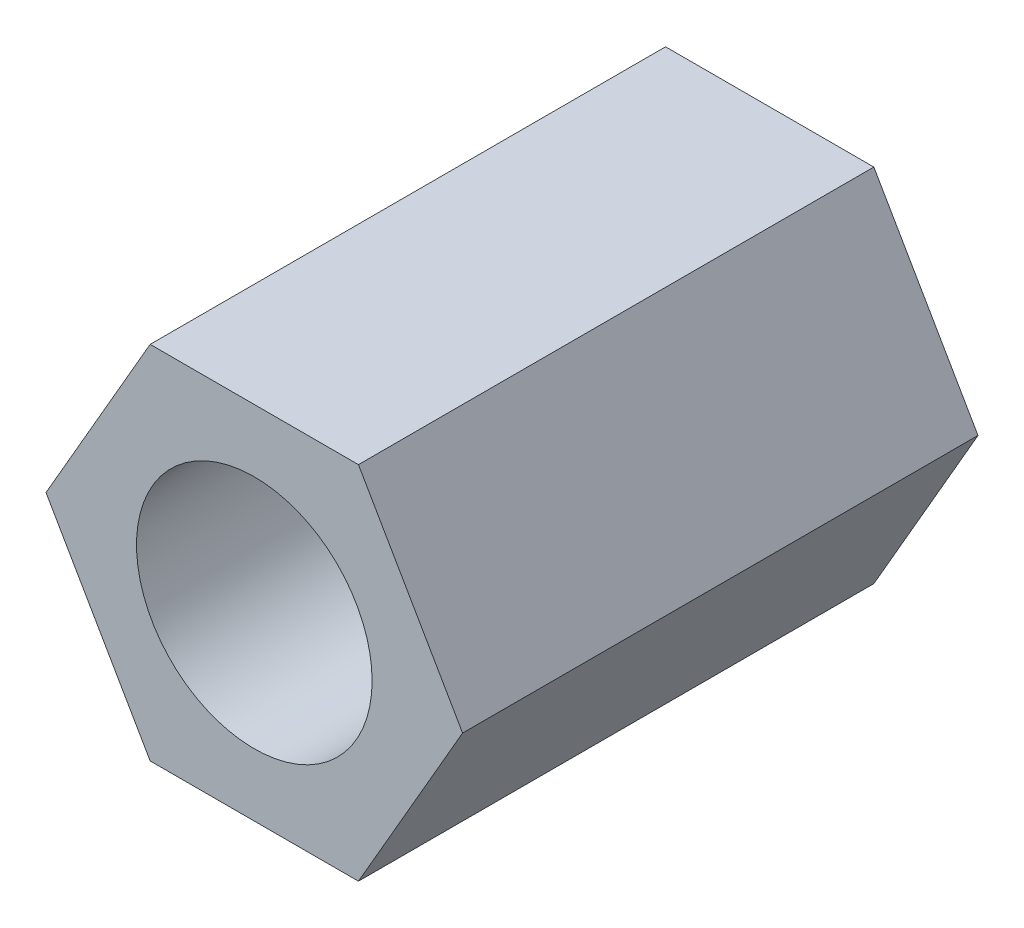
from build123d import *

# Parameters (mm, degrees)
SKETCH_1_R      = 1.6
EXTRUDE_1_DEPTH = 7


with BuildPart() as part:
    # 草图1 → 凸台-拉伸1 (new body)
    with BuildSketch(Plane.XY):
        Polygon((2.829016319, 0), (1.41450816, 2.45), (-1.41450816, 2.45), (-2.829016319, 0), (-1.41450816, -2.45), (1.41450816, -2.45), align=None)
        Circle(SKETCH_1_R, mode=Mode.SUBTRACT)
    extrude(amount=EXTRUDE_1_DEPTH)


solid = part.part
